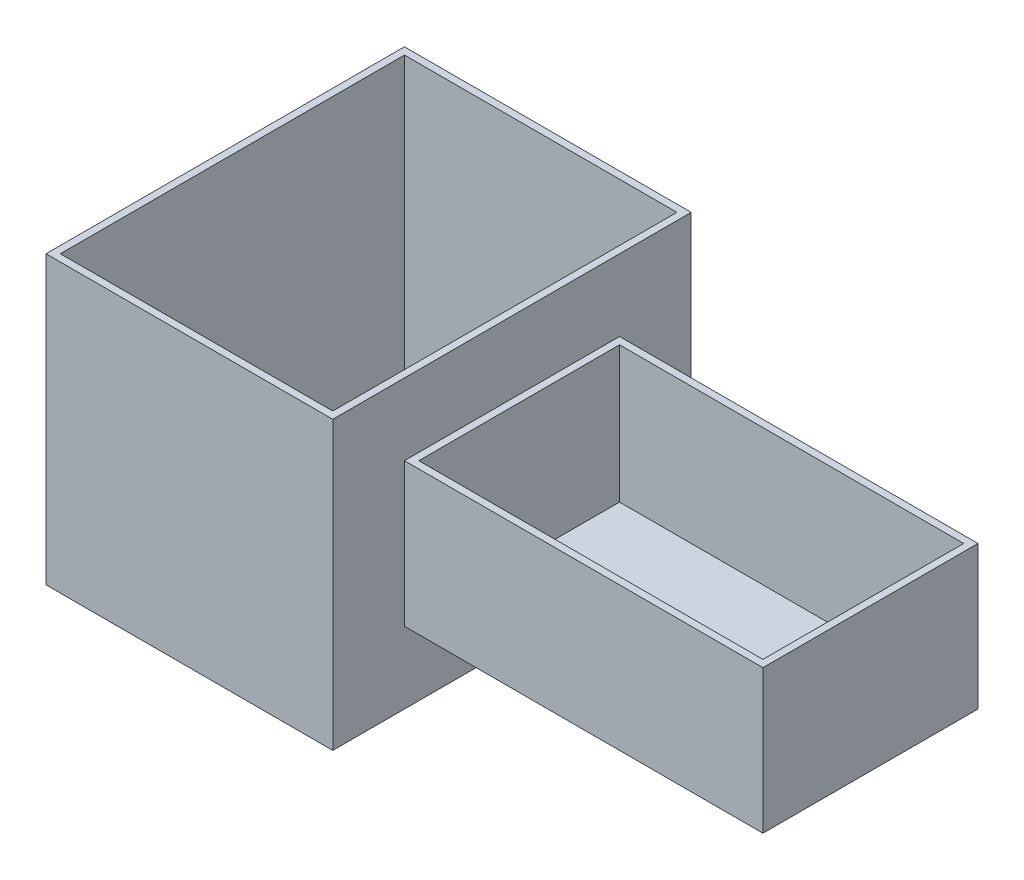
from build123d import *

# Parameters (mm, degrees)
SKETCH1_W           = 101.6
SKETCH1_H           = 127
SKETCH1_W_2         = 96.52
SKETCH1_H_2         = 121.92
EXTRUDE_THIN1_DEPTH = 101.6
SKETCH1_2_W         = 101.6
SKETCH1_2_H         = 127
BOSS_EXTRUDE1_DEPTH = 2.54
SKETCH2_W           = 127
SKETCH2_H           = 76.2
SKETCH2_W_2         = 121.92
SKETCH2_H_2         = 71.12
EXTRUDE_THIN2_DEPTH = 50.8
SKETCH2_2_W         = 127
SKETCH2_2_H         = 76.2
BOSS_EXTRUDE2_DEPTH = 2.54


with BuildPart() as part:
    # Sketch1 → Extrude-Thin1 (new body)
    with BuildSketch(Plane(origin=(0, 0, 0), x_dir=(1, 0, 0), z_dir=(0, 1, 0))):
        Rectangle(SKETCH1_W, SKETCH1_H)
        Rectangle(SKETCH1_W_2, SKETCH1_H_2, mode=Mode.SUBTRACT)
    extrude(amount=EXTRUDE_THIN1_DEPTH)

    # Sketch1<2> → Boss-Extrude1 (add)
    with BuildSketch(Plane(origin=(0, 0, 0), x_dir=(1, 0, 0), z_dir=(0, 1, 0))):
        Rectangle(SKETCH1_2_W, SKETCH1_2_H)
    extrude(amount=BOSS_EXTRUDE1_DEPTH)

    # Sketch2 → Extrude-Thin2 (add)
    with BuildSketch(Plane(origin=(0, 25.4, 0), x_dir=(1, 0, 0), z_dir=(0, 1, 0))):
        with Locations((114.3, 0)):
            Rectangle(SKETCH2_W, SKETCH2_H)
        with Locations((114.3, 0)):
            Rectangle(SKETCH2_W_2, SKETCH2_H_2, mode=Mode.SUBTRACT)
    extrude(amount=EXTRUDE_THIN2_DEPTH)

    # Sketch2<2> → Boss-Extrude2 (add)
    with BuildSketch(Plane(origin=(0, 25.4, 0), x_dir=(1, 0, 0), z_dir=(0, 1, 0))):
        with Locations((114.3, 0)):
            Rectangle(SKETCH2_2_W, SKETCH2_2_H)
    extrude(amount=BOSS_EXTRUDE2_DEPTH)


solid = part.part
